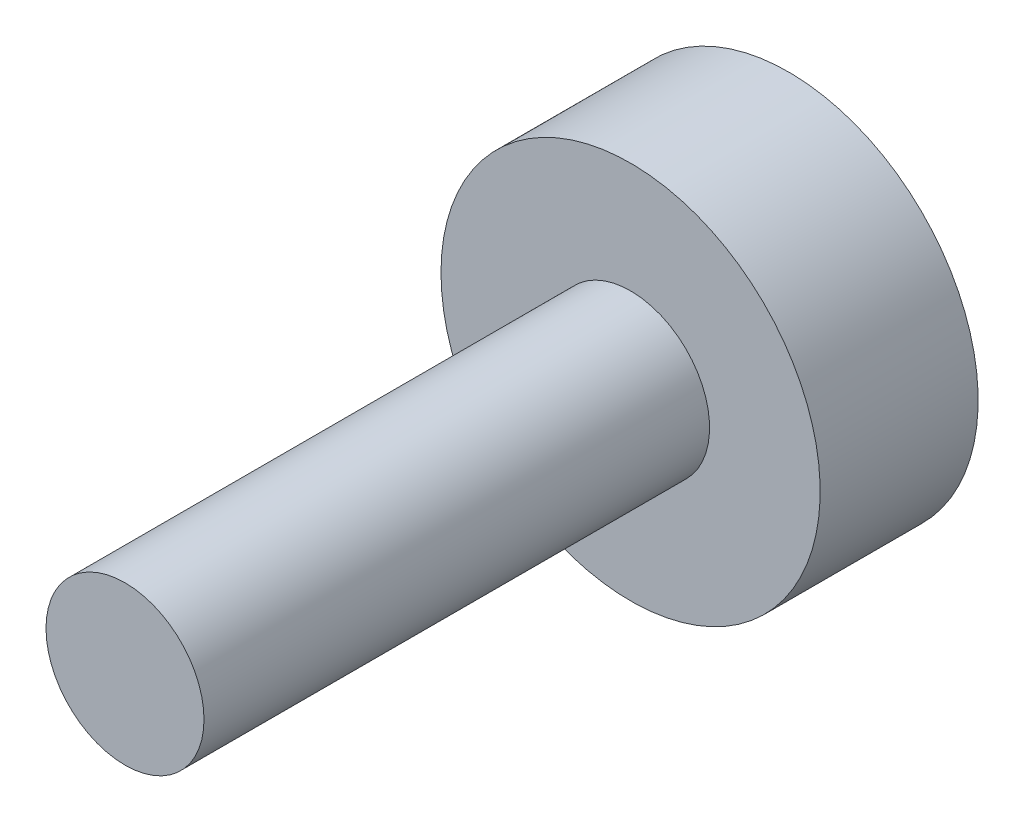
from build123d import *

# Parameters (mm, degrees)
SKETCH1_R           = 2.5
BOSS_EXTRUDE1_DEPTH = 16
SKETCH2_R           = 6
BOSS_EXTRUDE2_DEPTH = 5


with BuildPart() as part:
    # Sketch1 → Boss-Extrude1 (new body)
    with BuildSketch(Plane.XY):
        Circle(SKETCH1_R)
    extrude(amount=BOSS_EXTRUDE1_DEPTH)

    # Sketch2 → Boss-Extrude2 (add)
    with BuildSketch(Plane(origin=(0, 0, 0), x_dir=(-1, 0, 0), z_dir=(0, 0, -1))):
        Circle(SKETCH2_R)
    extrude(amount=BOSS_EXTRUDE2_DEPTH)


solid = part.part
